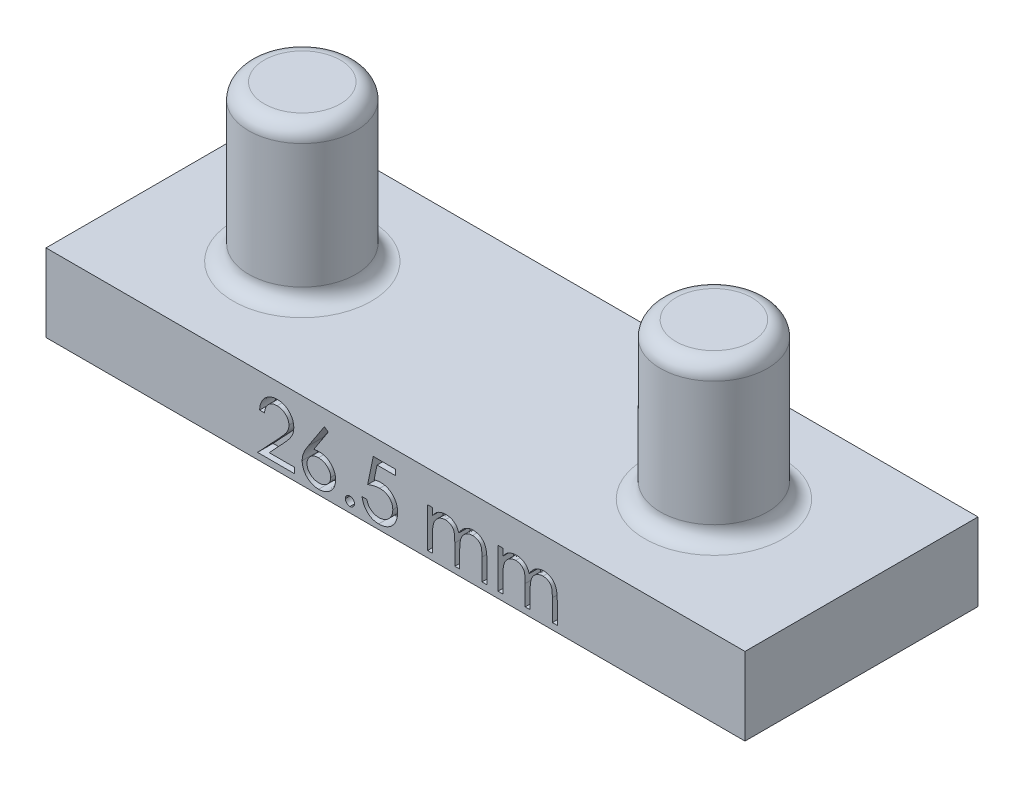
from build123d import *

# Parameters (mm, degrees)
SKETCH1_R             = 3.448679322
BOSS_EXTRUDE1_DEPTH   = 10
BOSS_EXTRUDE1_2_DEPTH = 10
SKETCH2_W             = 45
SKETCH2_H             = 15
BOSS_EXTRUDE2_DEPTH   = 5
CUT_EXTRUDE1_DEPTH    = 1
FILLET1_R             = 1


with BuildPart() as part:
    # Sketch1 → Boss-Extrude1 (new body)
    with BuildSketch(Plane(origin=(0, 0, 0), x_dir=(1, 0, 0), z_dir=(0, 1, 0))):
        with Locations(Location((-41.821276596, 3.10212766, 0), (0, 0, 270))):
            Circle(SKETCH1_R)
    extrude(amount=BOSS_EXTRUDE1_DEPTH)



with BuildPart() as body_2:
    # Sketch1 → Boss-Extrude1 2 (new body)
    with BuildSketch(Plane(origin=(0, 0, 0), x_dir=(1, 0, 0), z_dir=(0, 1, 0))):
        with Locations(Location((-15.321276596, 3.10212766, 0), (0, 0, 270))):
            Circle(SKETCH1_R)
    extrude(amount=BOSS_EXTRUDE1_2_DEPTH)


with BuildPart() as part_1:
    add(part.part)

    add(body_2.part)  # Boss-Extrude2 merges body 2
    # Sketch2 → Boss-Extrude2 (add)
    with BuildSketch(Plane.XZ):
        with Locations((-28.321276596, -3.10212766)):
            Rectangle(SKETCH2_W, SKETCH2_H)
    extrude(amount=BOSS_EXTRUDE2_DEPTH)

    # Sketch3 → Cut-Extrude1 (cut)
    # profile 1 of 6: a face of its own
    with BuildSketch(Plane.XY.offset(4.39787234)):
        with BuildLine():
            Line((-21.721415096, -2.034062219), (-21.407312532, -2.034062219))
            Line((-21.407312532, -2.034062219), (-21.407312532, -2.478573436))
            add(Edge.make_bspline(
                [(-21.407312532, -2.478573436), (-21.379028582, -2.439685835), (-21.324833822, -2.365173462), (-21.23596817, -2.266983177), (-21.147192057, -2.183655023), (-21.083258676, -2.139912151), (-21.052544904, -2.118897956)],
                knots=[0, 0, 0, 0, 1.134379233, 2.173579362, 3.122582517, 4, 4, 4, 4], degree=3))
            add(Edge.make_bspline(
                [(-21.052544904, -2.118897956), (-21.010680241, -2.09889259), (-20.927682342, -2.059231377), (-20.796263117, -2.018997818), (-20.661788447, -1.994272717), (-20.570980233, -1.990891343), (-20.525301314, -1.989190424)],
                knots=[0, 0, 0, 0, 1.014936303, 2.012140481, 3.000054389, 4, 4, 4, 4], degree=3))
            add(Edge.make_bspline(
                [(-20.525301314, -1.989190424), (-20.494408317, -1.990235714), (-20.433272738, -1.992304289), (-20.342688648, -2.005764324), (-20.254830036, -2.029030497), (-20.170216007, -2.061437821), (-20.090495328, -2.100684508), (-20.01740613, -2.146734216), (-19.951781922, -2.198431291), (-19.893655871, -2.258110224), (-19.841386845, -2.327446823), (-19.793307998, -2.408311072), (-19.748882786, -2.502518733), (-19.724261477, -2.570885274), (-19.71129891, -2.606878725)],
                knots=[0, 0, 0, 0, 1.009824226, 1.998387844, 2.986035974, 3.974953746, 4.955485308, 5.885931332, 6.793869504, 7.679848016, 8.601185859, 9.625726857, 10.749998409, 12, 12, 12, 12], degree=3))
            add(Edge.make_bspline(
                [(-19.71129891, -2.606878725), (-19.697587659, -2.582154306), (-19.670605842, -2.533500121), (-19.625300205, -2.464641858), (-19.577832408, -2.400235067), (-19.527797915, -2.340228642), (-19.475373328, -2.284918912), (-19.420311928, -2.23412301), (-19.362927146, -2.187622797), (-19.283134906, -2.133299637), (-19.179322299, -2.075598456), (-19.048434184, -2.025570012), (-18.912284013, -1.994653883), (-18.819866315, -1.99102361), (-18.773197949, -1.989190424)],
                knots=[0, 0, 0, 0, 0.86119277, 1.694706429, 2.50939023, 3.298075842, 4.073795165, 4.829715201, 5.57930267, 6.321991688, 7.768977793, 9.186738141, 10.579381044, 12, 12, 12, 12], degree=3))
            add(Edge.make_bspline(
                [(-18.773197949, -1.989190424), (-18.730316486, -1.990807645), (-18.646393299, -1.993972703), (-18.524216034, -2.018826176), (-18.410274228, -2.061503823), (-18.304797152, -2.11973746), (-18.209637339, -2.192916643), (-18.12692103, -2.279985481), (-18.057150666, -2.380328104), (-18.011572027, -2.474720092), (-17.980656762, -2.558055425), (-17.961595528, -2.629061717), (-17.944755833, -2.707213269), (-17.930774588, -2.792603531), (-17.920556036, -2.885534139), (-17.91298532, -2.985853015), (-17.907861247, -3.093638127), (-17.907499174, -3.168003627), (-17.907312532, -3.20633786)],
                knots=[0, 0, 0, 0, 1.209669288, 2.367440248, 3.500751976, 4.631527125, 5.755587489, 6.87532382, 8.007944318, 9.190864318, 9.82315674, 10.514484317, 11.263564316, 12.079023757, 12.955305781, 13.901327259, 14.918167583, 16, 16, 16, 16], degree=3))
            Line((-17.907312532, -3.20633786), (-17.907312532, -4.591754526))
            Line((-17.907312532, -4.591754526), (-18.221415096, -4.591754526))
            Line((-18.221415096, -4.591754526), (-18.221415096, -3.204935616))
            add(Edge.make_bspline(
                [(-18.221415096, -3.204935616), (-18.221492979, -3.172215042), (-18.221642658, -3.109331075), (-18.22433629, -3.019078624), (-18.229411604, -2.936810267), (-18.235346243, -2.862638179), (-18.243590052, -2.79638939), (-18.254235984, -2.738196972), (-18.265513664, -2.68760316), (-18.284249655, -2.631517113), (-18.314197546, -2.569646902), (-18.359815026, -2.502923326), (-18.417285133, -2.444842526), (-18.483645289, -2.394424209), (-18.559193734, -2.353430568), (-18.642458457, -2.324154558), (-18.732922509, -2.30603168), (-18.795545297, -2.304225665), (-18.827885449, -2.303292988)],
                knots=[0, 0, 0, 0, 1.253487763, 2.409012846, 3.458416907, 4.410876679, 5.259312806, 6.014470957, 6.676830364, 7.243083969, 8.276244668, 9.299465089, 10.325150304, 11.392391894, 12.482080715, 13.603491619, 14.762376348, 16, 16, 16, 16], degree=3))
            add(Edge.make_bspline(
                [(-18.827885449, -2.303292988), (-18.867555403, -2.304709145), (-18.945958314, -2.307508011), (-19.0604038, -2.336081884), (-19.170374817, -2.379162134), (-19.27258995, -2.441594591), (-19.36661774, -2.516402955), (-19.447517318, -2.605352551), (-19.514349504, -2.705982478), (-19.55960348, -2.79912918), (-19.588192781, -2.882798624), (-19.607069697, -2.955895996), (-19.621753088, -3.038977564), (-19.635523617, -3.131485055), (-19.644511345, -3.234055235), (-19.652679718, -3.346213636), (-19.656500581, -3.468297596), (-19.657035039, -3.552924284), (-19.657312532, -3.596862699)],
                knots=[0, 0, 0, 0, 1.090531906, 2.155305635, 3.229839962, 4.33261226, 5.44038871, 6.529323825, 7.629011124, 8.757537029, 9.370236727, 10.061839251, 10.834451254, 11.692844982, 12.636905849, 13.66920014, 14.789842145, 16, 16, 16, 16], degree=3))
            Line((-19.657312532, -3.596862699), (-19.657312532, -4.591754526))
            Line((-19.657312532, -4.591754526), (-19.971415096, -4.591754526))
            Line((-19.971415096, -4.591754526), (-19.971415096, -3.291173597))
            add(Edge.make_bspline(
                [(-19.971415096, -3.291173597), (-19.971494527, -3.254480278), (-19.971647344, -3.183886021), (-19.974323661, -3.082652345), (-19.979410283, -2.990571265), (-19.985290832, -2.907749802), (-19.99375101, -2.834338473), (-20.003360772, -2.769943715), (-20.014709383, -2.714726964), (-20.033499267, -2.654163579), (-20.062213736, -2.587442656), (-20.108401998, -2.516301635), (-20.166009578, -2.454033537), (-20.233580454, -2.400874789), (-20.309586136, -2.356933307), (-20.393569537, -2.325273556), (-20.48477445, -2.306849266), (-20.547652156, -2.304500769), (-20.579988814, -2.303292988)],
                knots=[0, 0, 0, 0, 1.320475261, 2.540461679, 3.643808994, 4.639130445, 5.527981419, 6.302341397, 6.981980563, 7.553956391, 8.582137848, 9.585246428, 10.591171744, 11.620968678, 12.668337649, 13.738356861, 14.836885341, 16, 16, 16, 16], degree=3))
            add(Edge.make_bspline(
                [(-20.579988814, -2.303292988), (-20.618005025, -2.304823448), (-20.693769985, -2.3078736), (-20.805071954, -2.335327874), (-20.912557638, -2.378331949), (-21.014512337, -2.437991768), (-21.108186485, -2.511890847), (-21.190194752, -2.598805742), (-21.259137278, -2.697654776), (-21.304869093, -2.789819292), (-21.334367567, -2.871392567), (-21.353962902, -2.940743515), (-21.370802527, -3.017743763), (-21.383316549, -3.102630874), (-21.395396965, -3.194851968), (-21.401227274, -3.294866458), (-21.406898836, -3.402588546), (-21.407171251, -3.476961091), (-21.407312532, -3.515532571)],
                knots=[0, 0, 0, 0, 1.098833095, 2.189935336, 3.297829714, 4.440610912, 5.596351641, 6.740013378, 7.886572111, 9.072425424, 9.705826452, 10.395263256, 11.156850408, 11.985370555, 12.878090359, 13.847760091, 14.883794034, 16, 16, 16, 16], degree=3))
            Line((-21.407312532, -3.515532571), (-21.407312532, -4.591754526))
            Line((-21.407312532, -4.591754526), (-21.721415096, -4.591754526))
            Line((-21.721415096, -4.591754526), (-21.721415096, -2.034062219))
        make_face()
    # profile 2 of 6: a face of its own
    with BuildSketch(Plane.XY.offset(4.39787234)):
        with BuildLine():
            Line((-26.253466378, -2.034062219), (-25.939363814, -2.034062219))
            Line((-25.939363814, -2.034062219), (-25.939363814, -2.478573436))
            add(Edge.make_bspline(
                [(-25.939363814, -2.478573436), (-25.911079864, -2.439685835), (-25.856885104, -2.365173462), (-25.768019452, -2.266983177), (-25.679243339, -2.183655023), (-25.615309958, -2.139912151), (-25.584596186, -2.118897956)],
                knots=[0, 0, 0, 0, 1.134379233, 2.173579362, 3.122582517, 4, 4, 4, 4], degree=3))
            add(Edge.make_bspline(
                [(-25.584596186, -2.118897956), (-25.542731524, -2.09889259), (-25.459733624, -2.059231377), (-25.328314399, -2.018997818), (-25.193839729, -1.994272717), (-25.103031515, -1.990891343), (-25.057352596, -1.989190424)],
                knots=[0, 0, 0, 0, 1.014936303, 2.012140481, 3.000054389, 4, 4, 4, 4], degree=3))
            add(Edge.make_bspline(
                [(-25.057352596, -1.989190424), (-25.026459599, -1.990235714), (-24.96532402, -1.992304289), (-24.87473993, -2.005764324), (-24.786881318, -2.029030497), (-24.702267289, -2.061437821), (-24.62254661, -2.100684508), (-24.549457412, -2.146734216), (-24.483833204, -2.198431291), (-24.425707153, -2.258110224), (-24.373438127, -2.327446823), (-24.325359281, -2.408311072), (-24.280934068, -2.502518733), (-24.256312759, -2.570885274), (-24.243350192, -2.606878725)],
                knots=[0, 0, 0, 0, 1.009824226, 1.998387844, 2.986035974, 3.974953746, 4.955485308, 5.885931332, 6.793869504, 7.679848016, 8.601185859, 9.625726857, 10.749998409, 12, 12, 12, 12], degree=3))
            add(Edge.make_bspline(
                [(-24.243350192, -2.606878725), (-24.229638941, -2.582154306), (-24.202657124, -2.533500121), (-24.157351487, -2.464641858), (-24.10988369, -2.400235067), (-24.059849197, -2.340228642), (-24.00742461, -2.284918912), (-23.95236321, -2.23412301), (-23.894978428, -2.187622797), (-23.815186189, -2.133299637), (-23.711373581, -2.075598456), (-23.580485466, -2.025570012), (-23.444335295, -1.994653883), (-23.351917597, -1.99102361), (-23.305249231, -1.989190424)],
                knots=[0, 0, 0, 0, 0.86119277, 1.694706429, 2.50939023, 3.298075842, 4.073795165, 4.829715201, 5.57930267, 6.321991688, 7.768977793, 9.186738141, 10.579381044, 12, 12, 12, 12], degree=3))
            add(Edge.make_bspline(
                [(-23.305249231, -1.989190424), (-23.262367768, -1.990807645), (-23.178444581, -1.993972703), (-23.056267316, -2.018826176), (-22.94232551, -2.061503823), (-22.836848434, -2.11973746), (-22.741688621, -2.192916643), (-22.658972312, -2.279985481), (-22.589201948, -2.380328104), (-22.543623309, -2.474720092), (-22.512708044, -2.558055425), (-22.49364681, -2.629061717), (-22.476807115, -2.707213269), (-22.46282587, -2.792603531), (-22.452607318, -2.885534139), (-22.445036602, -2.985853015), (-22.439912529, -3.093638127), (-22.439550456, -3.168003627), (-22.439363814, -3.20633786)],
                knots=[0, 0, 0, 0, 1.209669288, 2.367440248, 3.500751976, 4.631527125, 5.755587489, 6.87532382, 8.007944318, 9.190864318, 9.82315674, 10.514484317, 11.263564316, 12.079023757, 12.955305781, 13.901327259, 14.918167583, 16, 16, 16, 16], degree=3))
            Line((-22.439363814, -3.20633786), (-22.439363814, -4.591754526))
            Line((-22.439363814, -4.591754526), (-22.753466378, -4.591754526))
            Line((-22.753466378, -4.591754526), (-22.753466378, -3.204935616))
            add(Edge.make_bspline(
                [(-22.753466378, -3.204935616), (-22.753544261, -3.172215042), (-22.75369394, -3.109331075), (-22.756387572, -3.019078624), (-22.761462886, -2.936810267), (-22.767397525, -2.862638179), (-22.775641334, -2.79638939), (-22.786287266, -2.738196972), (-22.797564946, -2.68760316), (-22.816300937, -2.631517113), (-22.846248828, -2.569646902), (-22.891866308, -2.502923326), (-22.949336415, -2.444842526), (-23.015696571, -2.394424209), (-23.091245016, -2.353430568), (-23.174509739, -2.324154558), (-23.264973791, -2.30603168), (-23.327596579, -2.304225665), (-23.359936731, -2.303292988)],
                knots=[0, 0, 0, 0, 1.253487763, 2.409012846, 3.458416907, 4.410876679, 5.259312806, 6.014470957, 6.676830364, 7.243083969, 8.276244668, 9.299465089, 10.325150304, 11.392391894, 12.482080715, 13.603491619, 14.762376348, 16, 16, 16, 16], degree=3))
            add(Edge.make_bspline(
                [(-23.359936731, -2.303292988), (-23.399606685, -2.304709145), (-23.478009596, -2.307508011), (-23.592455082, -2.336081884), (-23.702426099, -2.379162134), (-23.804641232, -2.441594591), (-23.898669022, -2.516402955), (-23.9795686, -2.605352551), (-24.046400786, -2.705982478), (-24.091654762, -2.79912918), (-24.120244063, -2.882798624), (-24.139120979, -2.955895996), (-24.15380437, -3.038977564), (-24.1675749, -3.131485055), (-24.176562628, -3.234055235), (-24.184731, -3.346213636), (-24.188551863, -3.468297596), (-24.189086321, -3.552924284), (-24.189363814, -3.596862699)],
                knots=[0, 0, 0, 0, 1.090531906, 2.155305635, 3.229839962, 4.33261226, 5.44038871, 6.529323825, 7.629011124, 8.757537029, 9.370236727, 10.061839251, 10.834451254, 11.692844982, 12.636905849, 13.66920014, 14.789842145, 16, 16, 16, 16], degree=3))
            Line((-24.189363814, -3.596862699), (-24.189363814, -4.591754526))
            Line((-24.189363814, -4.591754526), (-24.503466378, -4.591754526))
            Line((-24.503466378, -4.591754526), (-24.503466378, -3.291173597))
            add(Edge.make_bspline(
                [(-24.503466378, -3.291173597), (-24.503545809, -3.254480278), (-24.503698626, -3.183886021), (-24.506374944, -3.082652345), (-24.511461565, -2.990571265), (-24.517342114, -2.907749802), (-24.525802292, -2.834338473), (-24.535412054, -2.769943715), (-24.546760665, -2.714726964), (-24.565550549, -2.654163579), (-24.594265018, -2.587442656), (-24.64045328, -2.516301635), (-24.69806086, -2.454033537), (-24.765631736, -2.400874789), (-24.841637418, -2.356933307), (-24.925620819, -2.325273556), (-25.016825732, -2.306849266), (-25.079703438, -2.304500769), (-25.112040096, -2.303292988)],
                knots=[0, 0, 0, 0, 1.320475261, 2.540461679, 3.643808994, 4.639130445, 5.527981419, 6.302341397, 6.981980563, 7.553956391, 8.582137848, 9.585246428, 10.591171744, 11.620968678, 12.668337649, 13.738356861, 14.836885341, 16, 16, 16, 16], degree=3))
            add(Edge.make_bspline(
                [(-25.112040096, -2.303292988), (-25.150056307, -2.304823448), (-25.225821267, -2.3078736), (-25.337123236, -2.335327874), (-25.44460892, -2.378331949), (-25.546563619, -2.437991768), (-25.640237767, -2.511890847), (-25.722246034, -2.598805742), (-25.79118856, -2.697654776), (-25.836920375, -2.789819292), (-25.866418849, -2.871392567), (-25.886014184, -2.940743515), (-25.90285381, -3.017743763), (-25.915367831, -3.102630874), (-25.927448247, -3.194851968), (-25.933278556, -3.294866458), (-25.938950118, -3.402588546), (-25.939222533, -3.476961091), (-25.939363814, -3.515532571)],
                knots=[0, 0, 0, 0, 1.098833095, 2.189935336, 3.297829714, 4.440610912, 5.596351641, 6.740013378, 7.886572111, 9.072425424, 9.705826452, 10.395263256, 11.156850408, 11.985370555, 12.878090359, 13.847760091, 14.883794034, 16, 16, 16, 16], degree=3))
            Line((-25.939363814, -3.515532571), (-25.939363814, -4.591754526))
            Line((-25.939363814, -4.591754526), (-26.253466378, -4.591754526))
            Line((-26.253466378, -4.591754526), (-26.253466378, -2.034062219))
        make_face()
    # profile 3 of 6: a face of its own
    with BuildSketch(Plane.XY.offset(4.39787234)):
        with BuildLine():
            Line((-28.317568942, -1.091754526), (-28.317568942, -1.450728885))
            Line((-28.317568942, -1.450728885), (-29.50807375, -1.450728885))
            Line((-29.50807375, -1.450728885), (-29.696675513, -2.371301802))
            add(Edge.make_bspline(
                [(-29.696675513, -2.371301802), (-29.659619638, -2.36107153), (-29.587829742, -2.341251996), (-29.481869881, -2.319246226), (-29.381277678, -2.305980782), (-29.316002308, -2.304169471), (-29.284415897, -2.303292988)],
                knots=[0, 0, 0, 0, 1.100273476, 2.13160584, 3.095893838, 4, 4, 4, 4], degree=3))
            add(Edge.make_bspline(
                [(-29.284415897, -2.303292988), (-29.245332158, -2.304138923), (-29.16848376, -2.305802244), (-29.056044813, -2.321774094), (-28.94871192, -2.346914008), (-28.84670955, -2.38203453), (-28.749848999, -2.426944263), (-28.659021438, -2.483044204), (-28.572863525, -2.548577535), (-28.492920931, -2.623922547), (-28.420396623, -2.706844164), (-28.356630633, -2.796002035), (-28.302468043, -2.890529697), (-28.258907288, -2.991330306), (-28.224122953, -3.097289459), (-28.200970959, -3.209522042), (-28.18555425, -3.326970162), (-28.183831863, -3.407274732), (-28.182953557, -3.448224879)],
                knots=[0, 0, 0, 0, 1.052922333, 2.070308379, 3.05430497, 4.020497103, 4.973039431, 5.925935799, 6.892292201, 7.88610001, 8.88166317, 9.857072816, 10.836096531, 11.812156883, 12.81219415, 13.836441305, 14.89672472, 16, 16, 16, 16], degree=3))
            add(Edge.make_bspline(
                [(-28.182953557, -3.448224879), (-28.183618633, -3.476747099), (-28.184939795, -3.533406087), (-28.191658383, -3.617550287), (-28.204594099, -3.69991312), (-28.221961823, -3.780505512), (-28.244504241, -3.859174885), (-28.271793295, -3.936146412), (-28.305189323, -4.010941019), (-28.341820698, -4.084266414), (-28.383067176, -4.154464921), (-28.428845683, -4.220113908), (-28.477211174, -4.282198189), (-28.52925256, -4.340051922), (-28.585453555, -4.39329494), (-28.645133522, -4.442243222), (-28.707816241, -4.487724552), (-28.774471483, -4.527892747), (-28.843613966, -4.564855703), (-28.916242183, -4.595179241), (-28.990702884, -4.622289769), (-29.068067759, -4.643899296), (-29.148161572, -4.660831851), (-29.231116347, -4.672332452), (-29.316497018, -4.680708889), (-29.37437203, -4.681233246), (-29.403606602, -4.681498116)],
                knots=[0, 0, 0, 0, 1.056347294, 2.098418968, 3.122841568, 4.141288669, 5.149314143, 6.15115421, 7.162517403, 8.180376062, 9.185164535, 10.17417709, 11.141909838, 12.097768115, 13.052685741, 14.0056014, 14.954263652, 15.917497458, 16.885230207, 17.854509472, 18.828990115, 19.81800267, 20.826176721, 21.857883937, 22.917946725, 24, 24, 24, 24], degree=3))
            add(Edge.make_bspline(
                [(-29.403606602, -4.681498116), (-29.438480783, -4.680807278), (-29.507091614, -4.679448136), (-29.607612181, -4.665229651), (-29.704326787, -4.644865734), (-29.796456888, -4.614229464), (-29.884828151, -4.57584217), (-29.968250869, -4.527325998), (-30.048856645, -4.472346894), (-30.123368682, -4.407466541), (-30.192524795, -4.336550859), (-30.254431304, -4.259593218), (-30.309564881, -4.177863776), (-30.357042628, -4.090965622), (-30.397540649, -3.999127091), (-30.429355638, -3.90200409), (-30.455033993, -3.800104086), (-30.465897413, -3.729950576), (-30.471415096, -3.694318629)],
                knots=[0, 0, 0, 0, 1.0467383, 2.05933395, 3.04377827, 4.011590433, 4.970194871, 5.932262533, 6.905835911, 7.896367577, 8.894135286, 9.877477877, 10.858688626, 11.851381753, 12.8477658, 13.868841284, 14.917554742, 16, 16, 16, 16], degree=3))
            Line((-30.471415096, -3.694318629), (-30.157312532, -3.694318629))
            add(Edge.make_bspline(
                [(-30.157312532, -3.694318629), (-30.149583974, -3.727695081), (-30.134729258, -3.791846476), (-30.102123509, -3.881977817), (-30.062257634, -3.962297041), (-30.014853285, -4.033866624), (-29.958303255, -4.096275622), (-29.893773826, -4.151892684), (-29.821426103, -4.202067813), (-29.741032873, -4.24389058), (-29.656219794, -4.279559334), (-29.567452584, -4.303311028), (-29.477148237, -4.320011921), (-29.416069867, -4.321683682), (-29.385377436, -4.322523757)],
                knots=[0, 0, 0, 0, 1.136247022, 2.183929868, 3.172523383, 4.106158343, 5.02341133, 5.958108904, 6.928429099, 7.938127109, 8.96079061, 9.975095812, 10.982467395, 12, 12, 12, 12], degree=3))
            add(Edge.make_bspline(
                [(-29.385377436, -4.322523757), (-29.355418991, -4.321702979), (-29.296430569, -4.320086861), (-29.209619182, -4.307647849), (-29.125806308, -4.288490277), (-29.045818951, -4.259820422), (-28.968257412, -4.224975704), (-28.895083641, -4.180260628), (-28.824180764, -4.12880061), (-28.757752631, -4.06984398), (-28.696913182, -4.004874285), (-28.64315706, -3.935396892), (-28.598380147, -3.861280045), (-28.560646038, -3.783806892), (-28.531992739, -3.702128335), (-28.511551758, -3.61662716), (-28.499548699, -3.52709218), (-28.497897519, -3.46602287), (-28.497056122, -3.434903565)],
                knots=[0, 0, 0, 0, 1.027316725, 2.022795036, 3.002884548, 3.971462791, 4.93288096, 5.914575861, 6.907176829, 7.935150275, 8.956128384, 9.956726525, 10.942570165, 11.921478529, 12.907843606, 13.90538589, 14.932640048, 16, 16, 16, 16], degree=3))
            add(Edge.make_bspline(
                [(-28.497056122, -3.434903565), (-28.497714601, -3.406827813), (-28.499003481, -3.351873524), (-28.509534051, -3.271474318), (-28.527851024, -3.195401275), (-28.553274904, -3.123287041), (-28.585554411, -3.055063599), (-28.625000724, -2.990660539), (-28.672354122, -2.930926706), (-28.72644601, -2.875834152), (-28.785704051, -2.824989277), (-28.851147794, -2.781645191), (-28.92140772, -2.745181273), (-28.99563732, -2.713713275), (-29.075602218, -2.691112529), (-29.159718851, -2.674144644), (-29.248895559, -2.664329281), (-29.309866247, -2.662967393), (-29.341206763, -2.662267347)],
                knots=[0, 0, 0, 0, 1.045622112, 2.046656509, 3.013763289, 3.955457236, 4.890082067, 5.820317437, 6.762574623, 7.722996705, 8.69280354, 9.665887285, 10.63943826, 11.638615906, 12.663482002, 13.728887084, 14.832589034, 16, 16, 16, 16], degree=3))
            add(Edge.make_bspline(
                [(-29.341206763, -2.662267347), (-29.368335691, -2.662847938), (-29.424350047, -2.664046711), (-29.510272873, -2.672873208), (-29.600564596, -2.687112503), (-29.694879092, -2.70669875), (-29.7934996, -2.732329827), (-29.896218001, -2.763044327), (-30.003250267, -2.799766326), (-30.075367992, -2.82749854), (-30.112440737, -2.841754526)],
                knots=[0, 0, 0, 0, 0.817624296, 1.688186739, 2.600797293, 3.572016777, 4.590301741, 5.671205678, 6.80286297, 8, 8, 8, 8], degree=3))
            Line((-30.112440737, -2.841754526), (-29.753466378, -1.091754526))
            Line((-29.753466378, -1.091754526), (-28.317568942, -1.091754526))
        make_face()
    # profile 4 of 6: a face of its own
    with BuildSketch(Plane.XY.offset(4.39787234)):
        with BuildLine():
            add(Edge.make_bspline(
                [(-31.256671506, -4.053292988), (-31.237181294, -4.054451154), (-31.198973012, -4.056721605), (-31.143733883, -4.072298279), (-31.093739224, -4.099956939), (-31.049206979, -4.136819717), (-31.012500502, -4.181515381), (-30.98385615, -4.231111289), (-30.968415165, -4.286812882), (-30.966161253, -4.325242557), (-30.96500484, -4.344959654)],
                knots=[0, 0, 0, 0, 1.020151414, 1.999887582, 2.974338812, 3.990962822, 5.007586832, 5.987933904, 6.967670073, 8, 8, 8, 8], degree=3))
            add(Edge.make_bspline(
                [(-30.96500484, -4.344959654), (-30.96620044, -4.364202984), (-30.968558147, -4.402150548), (-30.983820756, -4.457432011), (-31.012718806, -4.507058915), (-31.048953799, -4.552361053), (-31.093750232, -4.589301924), (-31.143852079, -4.616725268), (-31.198843337, -4.633417248), (-31.23715966, -4.635543545), (-31.256671506, -4.636626321)],
                knots=[0, 0, 0, 0, 1.009421747, 1.99056486, 2.972319754, 3.999869655, 5.017953583, 5.993804169, 6.978383603, 8, 8, 8, 8], degree=3))
            add(Edge.make_bspline(
                [(-31.256671506, -4.636626321), (-31.276197412, -4.635582724), (-31.314317094, -4.633545349), (-31.369103089, -4.616382543), (-31.419510057, -4.589559082), (-31.464297769, -4.552292173), (-31.500836241, -4.507292029), (-31.528461623, -4.457090233), (-31.545051772, -4.402308796), (-31.547233645, -4.364234153), (-31.548338173, -4.344959654)],
                knots=[0, 0, 0, 0, 1.022052826, 1.995314843, 2.982371812, 4.00089066, 5.028879526, 6.005146991, 6.990147033, 8, 8, 8, 8], degree=3))
            add(Edge.make_bspline(
                [(-31.548338173, -4.344959654), (-31.547276074, -4.325210275), (-31.545202455, -4.286652035), (-31.528426795, -4.231452927), (-31.501050583, -4.181284488), (-31.464045188, -4.136887908), (-31.419520892, -4.099700605), (-31.369224687, -4.072635812), (-31.314185147, -4.0565954), (-31.276175208, -4.054412883), (-31.256671506, -4.053292988)],
                knots=[0, 0, 0, 0, 1.032775665, 2.016367738, 2.991239715, 4.008302682, 5.025365648, 6.011011707, 6.979408107, 8, 8, 8, 8], degree=3))
        make_face()
    # profile 5 of 6: a face of its own
    with BuildSketch(Plane.XY.offset(4.39787234)):
        with BuildLine():
            Line((-32.894492019, -1.002010936), (-32.652605, -1.192014943))
            Line((-32.652605, -1.192014943), (-33.577384647, -2.606177603))
            add(Edge.make_bspline(
                [(-33.577384647, -2.606177603), (-33.51581437, -2.596363743), (-33.395714583, -2.577220698), (-33.274148685, -2.574062752), (-33.214904679, -2.572523757)],
                knots=[0, 0, 0, 0, 1.025318673, 2, 2, 2, 2], degree=3))
            add(Edge.make_bspline(
                [(-33.214904679, -2.572523757), (-33.179332183, -2.573479869), (-33.109308782, -2.575361946), (-33.00650198, -2.589845797), (-32.907713044, -2.612670909), (-32.813351432, -2.645943165), (-32.72307845, -2.688445519), (-32.636376054, -2.739384389), (-32.554874044, -2.80139007), (-32.477522865, -2.870655025), (-32.407295767, -2.94737201), (-32.345119712, -3.028773347), (-32.29289292, -3.114774228), (-32.250518999, -3.205331094), (-32.21761412, -3.300304353), (-32.193626475, -3.399572493), (-32.179446882, -3.503203964), (-32.177521391, -3.573682139), (-32.176543301, -3.609482892)],
                knots=[0, 0, 0, 0, 1.04369286, 2.054478336, 3.041073146, 4.015093852, 4.984733326, 5.965804835, 6.960378782, 7.985147595, 9.009457201, 10.008161701, 10.986880575, 11.956520048, 12.937015923, 13.931873656, 14.949455224, 16, 16, 16, 16], degree=3))
            add(Edge.make_bspline(
                [(-32.176543301, -3.609482892), (-32.177966406, -3.658462596), (-32.18076674, -3.754843062), (-32.208670536, -3.895219768), (-32.25203018, -4.028952283), (-32.314007709, -4.153905455), (-32.390990092, -4.269908024), (-32.484867684, -4.37269349), (-32.592311173, -4.464363527), (-32.713797971, -4.541020146), (-32.844540935, -4.603623197), (-32.981892932, -4.648588439), (-33.124520079, -4.676271909), (-33.221324687, -4.679742512), (-33.270293301, -4.681498116)],
                knots=[0, 0, 0, 0, 1.031375318, 2.029502543, 3.004789286, 3.987476834, 4.960371455, 5.9300674, 6.912260825, 7.929083631, 8.949397511, 9.960523116, 10.96833055, 12, 12, 12, 12], degree=3))
            add(Edge.make_bspline(
                [(-33.270293301, -4.681498116), (-33.317390002, -4.67996991), (-33.41068032, -4.676942802), (-33.547913114, -4.649976864), (-33.679776131, -4.606269762), (-33.805345512, -4.546055483), (-33.921666125, -4.4699976), (-34.025731762, -4.378435321), (-34.117023536, -4.273325856), (-34.192998157, -4.154685509), (-34.253256889, -4.027195551), (-34.298446814, -3.894258395), (-34.324843057, -3.756358413), (-34.328531614, -3.662877274), (-34.330389455, -3.615792988)],
                knots=[0, 0, 0, 0, 1.012016664, 2.004627821, 2.994792927, 3.992885782, 4.990978636, 5.973936114, 6.964471063, 7.975201453, 8.993600317, 9.990122807, 10.98767138, 12, 12, 12, 12], degree=3))
            add(Edge.make_bspline(
                [(-34.330389455, -3.615792988), (-34.32920801, -3.579748405), (-34.326795725, -3.506152253), (-34.309952335, -3.394688225), (-34.28288754, -3.280637143), (-34.252577293, -3.183882949), (-34.220551683, -3.104621427), (-34.193899144, -3.040717937), (-34.160725148, -2.974956863), (-34.125351767, -2.905083228), (-34.084594898, -2.832897795), (-34.040279248, -2.757194125), (-33.991179597, -2.679176198), (-33.956759435, -2.626232002), (-33.939163493, -2.599166385)],
                knots=[0, 0, 0, 0, 1.173818275, 2.396712641, 3.66331629, 4.989737886, 5.693666774, 6.447286557, 7.243889047, 8.091586357, 8.998013824, 9.943181721, 10.948533338, 12, 12, 12, 12], degree=3))
            Line((-33.939163493, -2.599166385), (-32.894492019, -1.002010936))
        make_face()
        with BuildLine():
            add(Edge.make_bspline(
                [(-33.280810128, -2.931498116), (-33.307472373, -2.93227616), (-33.359551482, -2.933795905), (-33.435958897, -2.942621157), (-33.508272148, -2.959240222), (-33.577449282, -2.980406554), (-33.642196985, -3.009509614), (-33.702985825, -3.044861413), (-33.760050877, -3.086482591), (-33.812794428, -3.133783502), (-33.860614092, -3.185571535), (-33.901795223, -3.241041058), (-33.937317623, -3.298855261), (-33.966199442, -3.359497203), (-33.988689517, -3.422943702), (-34.004957768, -3.488902952), (-34.014011519, -3.557817258), (-34.015517751, -3.604549761), (-34.016286891, -3.62841318)],
                knots=[0, 0, 0, 0, 1.129588631, 2.206414736, 3.251139165, 4.268635594, 5.265702196, 6.250456724, 7.242448911, 8.251968645, 9.246821453, 10.222880186, 11.173611482, 12.116736599, 13.062300278, 14.020270554, 14.989073742, 16, 16, 16, 16], degree=3))
            add(Edge.make_bspline(
                [(-34.016286891, -3.62841318), (-34.015660529, -3.65206316), (-34.014432328, -3.69843725), (-34.003280008, -3.766776429), (-33.986244926, -3.832541338), (-33.96090453, -3.895392936), (-33.930677642, -3.956289254), (-33.890772317, -4.01302454), (-33.846555531, -4.06904461), (-33.793701598, -4.120046081), (-33.736978235, -4.167502706), (-33.676377033, -4.208982959), (-33.613217073, -4.244469133), (-33.546645651, -4.27228023), (-33.477607267, -4.295104517), (-33.405526713, -4.311165996), (-33.330353857, -4.320246522), (-33.279431919, -4.321754716), (-33.253466378, -4.322523757)],
                knots=[0, 0, 0, 0, 0.989467248, 1.94019797, 2.891935182, 3.827694429, 4.772920941, 5.730924762, 6.725747692, 7.756678648, 8.79901574, 9.819492441, 10.826891316, 11.826466727, 12.835195252, 13.867842842, 14.912794438, 16, 16, 16, 16], degree=3))
            add(Edge.make_bspline(
                [(-33.253466378, -4.322523757), (-33.227500879, -4.321754656), (-33.176579025, -4.320246344), (-33.101405565, -4.311166675), (-33.029327246, -4.295102027), (-32.960280737, -4.272289257), (-32.893739306, -4.244435647), (-32.830634585, -4.209203727), (-32.770606491, -4.16724761), (-32.713845892, -4.120127181), (-32.661211953, -4.068754329), (-32.615934675, -4.013524607), (-32.577251441, -3.955830712), (-32.545817254, -3.895632822), (-32.520755963, -3.832503334), (-32.503634496, -3.76678661), (-32.492505207, -3.698434584), (-32.491273841, -3.65206226), (-32.490645865, -3.62841318)],
                knots=[0, 0, 0, 0, 1.087397944, 2.132534446, 3.165364764, 4.174271784, 5.174024072, 6.181601208, 7.194203697, 8.236725232, 9.267838612, 10.269026844, 11.221737037, 12.171628256, 13.107553087, 14.05945871, 15.010357665, 16, 16, 16, 16], degree=3))
            add(Edge.make_bspline(
                [(-32.490645865, -3.62841318), (-32.491196158, -3.604518629), (-32.492276204, -3.557621397), (-32.504492153, -3.488933778), (-32.521434527, -3.422608572), (-32.547017558, -3.359062623), (-32.580254102, -3.298546696), (-32.620737509, -3.240755095), (-32.66757008, -3.185244748), (-32.721667619, -3.133681939), (-32.780557853, -3.086534861), (-32.843173439, -3.044915305), (-32.908681412, -3.009790328), (-32.977015355, -2.980483226), (-33.048958237, -2.959333752), (-33.123348576, -2.942680509), (-33.201137819, -2.933818491), (-33.253914427, -2.932281426), (-33.280810128, -2.931498116)],
                knots=[0, 0, 0, 0, 0.978206639, 1.919901502, 2.851605144, 3.780102724, 4.718870031, 5.675451981, 6.667674623, 7.690630536, 8.733308323, 9.756129687, 10.767539656, 11.776269907, 12.797430371, 13.836405707, 14.897401972, 16, 16, 16, 16], degree=3))
        make_face(mode=Mode.SUBTRACT)
    # profile 6 of 6: a face of its own
    with BuildSketch(Plane.XY.offset(4.39787234)):
        with BuildLine():
            Line((-36.753466378, -2.168677603), (-37.067568942, -2.168677603))
            add(Edge.make_bspline(
                [(-37.067568942, -2.168677603), (-37.065521789, -2.127006715), (-37.061501235, -2.045166201), (-37.042672946, -1.925842294), (-37.015732069, -1.811787496), (-36.977640615, -1.703917582), (-36.930334337, -1.601278774), (-36.873604309, -1.504278759), (-36.806410459, -1.41328757), (-36.730203725, -1.329148727), (-36.647435086, -1.251961156), (-36.558129146, -1.185305913), (-36.464284119, -1.128988242), (-36.36618472, -1.081907), (-36.262724157, -1.046567154), (-36.154841299, -1.020345514), (-36.042062162, -1.004569169), (-35.96522214, -1.002873383), (-35.92614266, -1.002010936)],
                knots=[0, 0, 0, 0, 1.10065271, 2.161652631, 3.183658789, 4.190468796, 5.17591951, 6.163126047, 7.15150782, 8.156236427, 9.156009102, 10.134482811, 11.092018607, 12.041330605, 13.001268258, 13.972401359, 14.968799086, 16, 16, 16, 16], degree=3))
            add(Edge.make_bspline(
                [(-35.92614266, -1.002010936), (-35.887764586, -1.002909393), (-35.812353041, -1.004674828), (-35.702291027, -1.019835857), (-35.597513732, -1.043581449), (-35.498225966, -1.076896865), (-35.405219901, -1.121681292), (-35.317796857, -1.175478831), (-35.234916046, -1.237698662), (-35.160309262, -1.310952476), (-35.091801183, -1.38915486), (-35.032698928, -1.472642764), (-34.982085764, -1.55887205), (-34.939898085, -1.648500251), (-34.908841946, -1.74237128), (-34.885263738, -1.839118482), (-34.871936324, -1.939743293), (-34.8698909, -2.007849849), (-34.868850993, -2.04247568)],
                knots=[0, 0, 0, 0, 1.111607364, 2.184268762, 3.212621178, 4.221274766, 5.211760367, 6.196651075, 7.1921475, 8.207485113, 9.220403448, 10.201281604, 11.166441695, 12.114753415, 13.065576456, 14.026450734, 14.996634279, 16, 16, 16, 16], degree=3))
            add(Edge.make_bspline(
                [(-34.868850993, -2.04247568), (-34.870544256, -2.091223515), (-34.873901068, -2.187863728), (-34.902615444, -2.329878591), (-34.947461955, -2.46747201), (-35.001459312, -2.578209312), (-35.055931756, -2.667442806), (-35.105019264, -2.740911511), (-35.162484075, -2.820016979), (-35.229162573, -2.904494317), (-35.303675445, -2.995005222), (-35.386697608, -3.091495017), (-35.47882109, -3.192966787), (-35.543479591, -3.262272388), (-35.576984006, -3.298184815)],
                knots=[0, 0, 0, 0, 1.184426356, 2.348067706, 3.509069118, 4.696110526, 5.333549288, 6.050745305, 6.844228056, 7.710549037, 8.667450064, 9.695053472, 10.805634456, 12, 12, 12, 12], degree=3))
            Line((-35.576984006, -3.298184815), (-36.452685128, -4.232780167))
            Line((-36.452685128, -4.232780167), (-34.823979199, -4.232780167))
            Line((-34.823979199, -4.232780167), (-34.823979199, -4.591754526))
            Line((-34.823979199, -4.591754526), (-37.202184327, -4.591754526))
            Line((-37.202184327, -4.591754526), (-35.844812532, -3.143236898))
            add(Edge.make_bspline(
                [(-35.844812532, -3.143236898), (-35.811764645, -3.108738591), (-35.748286418, -3.042474405), (-35.658503841, -2.945731445), (-35.577864853, -2.855981904), (-35.50584746, -2.773395356), (-35.444013955, -2.696763788), (-35.389141723, -2.628569084), (-35.345176132, -2.565814634), (-35.297460736, -2.49307402), (-35.251246755, -2.404261703), (-35.211534399, -2.295728014), (-35.18731955, -2.184000761), (-35.184414715, -2.108498724), (-35.182953557, -2.070520552)],
                knots=[0, 0, 0, 0, 1.329631726, 2.553950428, 3.673215718, 4.687767853, 5.603093632, 6.413772471, 7.123043292, 7.734684054, 8.834405432, 9.900288307, 10.943827018, 12, 12, 12, 12], degree=3))
            add(Edge.make_bspline(
                [(-35.182953557, -2.070520552), (-35.1835893, -2.046639153), (-35.184842226, -1.999573503), (-35.195899923, -1.930567744), (-35.212610429, -1.86400293), (-35.236555687, -1.799674311), (-35.268162428, -1.738228659), (-35.306635807, -1.679591179), (-35.351025871, -1.622902214), (-35.40237714, -1.569748916), (-35.45878866, -1.52106771), (-35.51838291, -1.477943625), (-35.581433014, -1.441904514), (-35.647673136, -1.412361017), (-35.716918605, -1.389185636), (-35.789303351, -1.373127056), (-35.864627367, -1.363044572), (-35.916060862, -1.3616804), (-35.942268461, -1.360985295)],
                knots=[0, 0, 0, 0, 0.991446411, 1.95395049, 2.89581595, 3.838931463, 4.798493298, 5.75982156, 6.748411868, 7.785213223, 8.824556874, 9.840280684, 10.836137867, 11.835679398, 12.848801643, 13.863922112, 14.911575587, 16, 16, 16, 16], degree=3))
            add(Edge.make_bspline(
                [(-35.942268461, -1.360985295), (-35.969639294, -1.361700328), (-36.02339109, -1.363104533), (-36.102310123, -1.372927197), (-36.177595901, -1.389873037), (-36.249437804, -1.413049712), (-36.31795739, -1.442508261), (-36.382821434, -1.479200005), (-36.443884323, -1.522983498), (-36.501260846, -1.572624055), (-36.554124825, -1.627891656), (-36.600571701, -1.689501619), (-36.641155715, -1.756329034), (-36.676564949, -1.828193585), (-36.705320639, -1.905747365), (-36.727293789, -1.98871507), (-36.744680636, -2.076736451), (-36.750489157, -2.137521536), (-36.753466378, -2.168677603)],
                knots=[0, 0, 0, 0, 1.031018746, 2.02475058, 2.990194455, 3.934040569, 4.864654155, 5.795059489, 6.735614925, 7.690564532, 8.649604399, 9.611025574, 10.590972636, 11.591080095, 12.624614302, 13.701020113, 14.821632451, 16, 16, 16, 16], degree=3))
        make_face()
    extrude(amount=-CUT_EXTRUDE1_DEPTH, mode=Mode.SUBTRACT)

    # Fillet1
    fillet1_edges = [part_1.edges().sort_by_distance(p)[0] for p in [
        (-15.321276596, 0, -6.550806982),
        (-15.321276596, 10, -6.550806982),
        (-41.821276596, 10, -6.550806982),
        (-41.821276596, 0, -6.550806982),
    ]]
    fillet(fillet1_edges, radius=FILLET1_R)


solid = part_1.part
